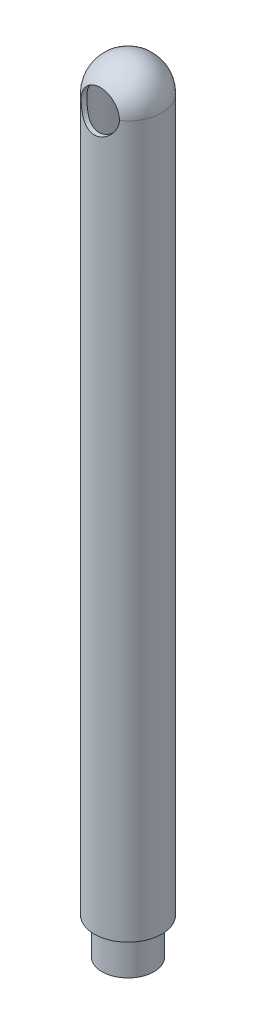
from build123d import *

# Parameters (mm, degrees)
CUT_EXTRUDE1_DEPTH      = 860.594090254
CUT_EXTRUDE1_DEPTH_BACK = 860.594090254
SKETCH2_R               = 21


with BuildPart() as part:
    # Sketch1 → Revolve1 (revolve)
    with BuildSketch(Plane.XY, mode=Mode.PRIVATE) as revolve1_sk:
        with BuildLine():
            ThreePointArc((32, 821), (22.627416998, 843.627416998), (0, 853))
            Line((0, 853), (0, 858))
            ThreePointArc((0, 858), (26.162950904, 847.162950904), (37, 821))
            Line((37, 821), (37, 40))
            Line((37, 40), (28.5, 40))
            Line((28.5, 40), (28.5, 0))
            Line((28.5, 0), (23.5, 0))
            Line((23.5, 0), (23.5, 45))
            Line((23.5, 45), (32, 45))
            Line((32, 45), (32, 821))
        make_face()
    revolve(revolve1_sk.sketch.rotate(Axis((0, 0, 0), (0, 1, 0)), 90), axis=Axis((0, 0, 0), (0, 1, 0)))

    # Sketch2 → Cut-Extrude1 (cut, two sides: drawn at the far end of the back side and taken through both)
    with BuildSketch(Plane.XY.offset(-CUT_EXTRUDE1_DEPTH_BACK)):
        with Locations((0, 821)):
            Circle(SKETCH2_R)
    extrude(amount=CUT_EXTRUDE1_DEPTH + CUT_EXTRUDE1_DEPTH_BACK, mode=Mode.SUBTRACT)


solid = part.part
